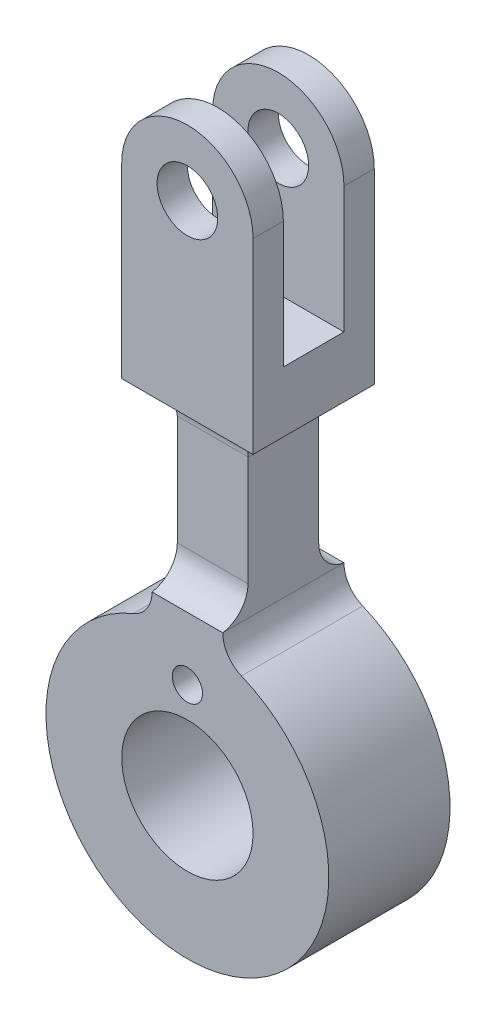
from build123d import *

# Parameters (mm, degrees)
SKETCH1_R               = 6.5
SKETCH1_R_2             = 1.5
SKETCH1_R_3             = 3
BOSS_EXTRUDE1_DEPTH     = 6
CUT_EXTRUDE1_DEPTH      = 60.483190903
CUT_EXTRUDE1_DEPTH_BACK = 60.483190903
SKETCH2_W               = 6
SKETCH2_H               = 19


with BuildPart() as part:
    # Sketch1 → Boss-Extrude1 (new, symmetric)
    with BuildSketch(Plane.XY):
        with BuildLine():
            Line((-3.5, 15.708278072), (-3.5, 29.5))
            ThreePointArc((-3.5, 29.5), (-4.378679656, 31.621320344), (-6.5, 32.5))
            Line((-6.5, 32.5), (-6.5, 51))
            ThreePointArc((-6.5, 51), (0, 57.5), (6.5, 51))
            Line((6.5, 51), (6.5, 32.5))
            ThreePointArc((6.5, 32.5), (4.378679656, 31.621320344), (3.5, 29.5))
            Line((3.5, 29.5), (3.5, 15.708278072))
            ThreePointArc((3.5, 15.708278072), (4.00588929, 14.041121282), (5.352941176, 12.936229001))
            ThreePointArc((5.352941176, 12.936229001), (0, -14), (-5.352941176, 12.936229001))
            ThreePointArc((-5.352941176, 12.936229001), (-4.00588929, 14.041121282), (-3.5, 15.708278072))
        make_face()
        Circle(SKETCH1_R, mode=Mode.SUBTRACT)
        with Locations((0, 9.5)):
            Circle(SKETCH1_R_2, mode=Mode.SUBTRACT)
        with Locations((0, 51)):
            Circle(SKETCH1_R_3, mode=Mode.SUBTRACT)
    extrude(amount=BOSS_EXTRUDE1_DEPTH, both=True)

    # Sketch2 → Cut-Extrude1 (cut, two sides: drawn at the far end of the back side and taken through both)
    with BuildSketch(Plane(origin=(0, 0, 0), x_dir=(0, 0, -1), z_dir=(1, 0, 0)).offset(-CUT_EXTRUDE1_DEPTH_BACK)):
        with BuildLine():
            Line((-6, 32.5), (-6, 15.708278072))
            ThreePointArc((-6, 15.708278072), (-4.208712153, 16.729826291), (-3.5, 18.666317964))
            Line((-3.5, 18.666317964), (-3.5, 29.541960108))
            ThreePointArc((-3.5, 29.541960108), (-4.208712153, 31.478451782), (-6, 32.5))
        make_face()
        with BuildLine():
            Line((6, 32.5), (6, 15.708278072))
            ThreePointArc((6, 15.708278072), (4.208712153, 16.729826291), (3.5, 18.666317964))
            Line((3.5, 18.666317964), (3.5, 29.541960108))
            ThreePointArc((3.5, 29.541960108), (4.208712153, 31.478451782), (6, 32.5))
        make_face()
        with Locations((0, 48)):
            Rectangle(SKETCH2_W, SKETCH2_H)
    extrude(amount=CUT_EXTRUDE1_DEPTH + CUT_EXTRUDE1_DEPTH_BACK, mode=Mode.SUBTRACT)


solid = part.part
